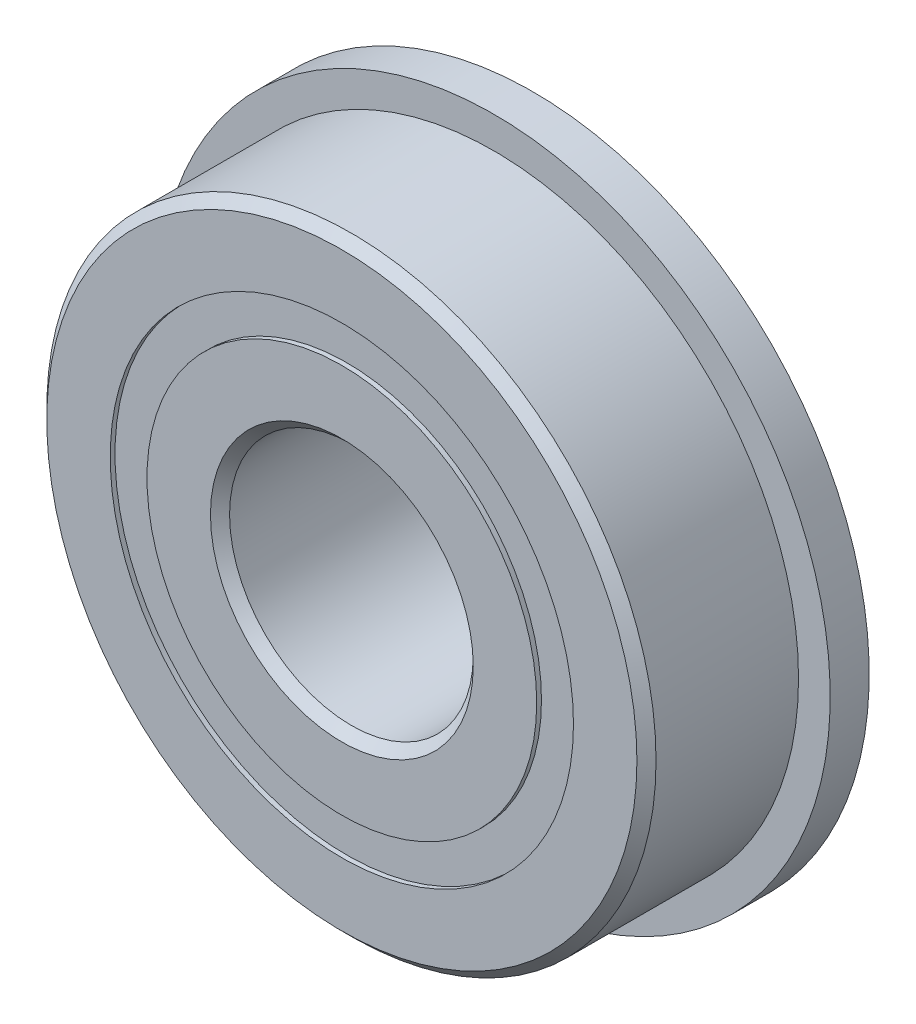
from build123d import *

# Parameters (mm, degrees)
CIRPATTERN1_COUNT = 12
SKETCH5_W         = 1.15919535
SKETCH5_H         = 0.957942858
SKETCH6_W         = 1.016
SKETCH6_H         = 2.727778571


with BuildPart() as part:
    # Sketch1 → Revolve1 (revolve)
    with BuildSketch(Plane(origin=(0, 0, 0), x_dir=(0, 0, -1), z_dir=(1, 0, 0))):
        with BuildLine():
            Line((2.24028, 7.9375), (-2.24028, 7.9375))
            Line((-2.24028, 7.9375), (-2.4892, 7.68858))
            Line((-2.4892, 7.68858), (-2.4892, 6.035221429))
            Line((-2.4892, 6.035221429), (-1.106311111, 6.035221429))
            ThreePointArc((-1.106311111, 6.035221429), (0, 6.76179465), (1.106311111, 6.035221429))
            Line((1.106311111, 6.035221429), (2.4892, 6.035221429))
            Line((2.4892, 6.035221429), (2.4892, 7.68858))
            Line((2.4892, 7.68858), (2.24028, 7.9375))
        make_face()
    revolve(axis=Axis((0, 0, 2.4892), (0, 0, -1)))

    # Sketch6 → Revolve6 (revolve)
    with BuildSketch(Plane(origin=(0, 0, 0), x_dir=(0, 0, -1), z_dir=(1, 0, 0))):
        with Locations((1.9812, 7.399110715)):
            Rectangle(SKETCH6_W, SKETCH6_H)
    revolve(axis=Axis((0, 0, -2.4892), (0, 0, 1)))


with BuildPart() as body_2:
    # Sketch3 → Revolve3 (revolve)
    with BuildSketch(Plane(origin=(0, 0, 0), x_dir=(0, 0, -1), z_dir=(1, 0, 0))):
        with BuildLine():
            Line((-2.4892, 5.077278571), (-1.106311111, 5.077278571))
            ThreePointArc((-1.106311111, 5.077278571), (0, 4.35070535), (1.106311111, 5.077278571))
            Line((1.106311111, 5.077278571), (2.4892, 5.077278571))
            Line((2.4892, 5.077278571), (2.4892, 3.42392))
            Line((2.4892, 3.42392), (2.24028, 3.175))
            Line((2.24028, 3.175), (-2.24028, 3.175))
            Line((-2.24028, 3.175), (-2.4892, 3.42392))
            Line((-2.4892, 3.42392), (-2.4892, 5.077278571))
        make_face()
    revolve(axis=Axis((0, 0, 2.4892), (0, 0, -1)))


with BuildPart() as body_3:
    # Sketch4 → Revolve4 (revolve)
    with BuildSketch(Plane(origin=(0, 0, 0), x_dir=(0, 0, -1), z_dir=(1, 0, 0))):
        with BuildLine():
            Line((-1.20554465, 5.55625), (1.20554465, 5.55625))
            ThreePointArc((1.20554465, 5.55625), (0, 6.76179465), (-1.20554465, 5.55625))
        make_face()
    revolve(axis=Axis((0, 5.55625, 1.20554465), (0, 0, -1)))


with BuildPart() as cirpattern1_1:
    # CirPattern1: pattern copy
    add(body_3.part.rotate(Axis((0, 0, -2.4892), (0, 0, 1)), 1 * 360 / CIRPATTERN1_COUNT))


with BuildPart() as cirpattern1_2:
    # CirPattern1: pattern copy
    add(body_3.part.rotate(Axis((0, 0, -2.4892), (0, 0, 1)), 2 * 360 / CIRPATTERN1_COUNT))


with BuildPart() as cirpattern1_3:
    # CirPattern1: pattern copy
    add(body_3.part.rotate(Axis((0, 0, -2.4892), (0, 0, 1)), 3 * 360 / CIRPATTERN1_COUNT))


with BuildPart() as cirpattern1_4:
    # CirPattern1: pattern copy
    add(body_3.part.rotate(Axis((0, 0, -2.4892), (0, 0, 1)), 4 * 360 / CIRPATTERN1_COUNT))


with BuildPart() as cirpattern1_5:
    # CirPattern1: pattern copy
    add(body_3.part.rotate(Axis((0, 0, -2.4892), (0, 0, 1)), 5 * 360 / CIRPATTERN1_COUNT))


with BuildPart() as cirpattern1_6:
    # CirPattern1: pattern copy
    add(body_3.part.rotate(Axis((0, 0, -2.4892), (0, 0, 1)), 6 * 360 / CIRPATTERN1_COUNT))


with BuildPart() as cirpattern1_7:
    # CirPattern1: pattern copy
    add(body_3.part.rotate(Axis((0, 0, -2.4892), (0, 0, 1)), 7 * 360 / CIRPATTERN1_COUNT))


with BuildPart() as cirpattern1_8:
    # CirPattern1: pattern copy
    add(body_3.part.rotate(Axis((0, 0, -2.4892), (0, 0, 1)), 8 * 360 / CIRPATTERN1_COUNT))


with BuildPart() as cirpattern1_9:
    # CirPattern1: pattern copy
    add(body_3.part.rotate(Axis((0, 0, -2.4892), (0, 0, 1)), 9 * 360 / CIRPATTERN1_COUNT))


with BuildPart() as cirpattern1_10:
    # CirPattern1: pattern copy
    add(body_3.part.rotate(Axis((0, 0, -2.4892), (0, 0, 1)), 10 * 360 / CIRPATTERN1_COUNT))


with BuildPart() as cirpattern1_11:
    # CirPattern1: pattern copy
    add(body_3.part.rotate(Axis((0, 0, -2.4892), (0, 0, 1)), 11 * 360 / CIRPATTERN1_COUNT))


with BuildPart() as body_15:
    # Sketch5 → Revolve5 (revolve)
    with BuildSketch(Plane(origin=(0, 0, 0), x_dir=(0, 0, -1), z_dir=(1, 0, 0))):
        with Locations((-1.785142325, 5.55625)):
            Rectangle(SKETCH5_W, SKETCH5_H)
        with Locations((1.785142325, 5.55625)):
            Rectangle(SKETCH5_W, SKETCH5_H)
    revolve(axis=Axis((0, 0, 2.4892), (0, 0, -1)))


solid = Compound([part.part, body_2.part, body_3.part, cirpattern1_1.part, cirpattern1_2.part, cirpattern1_3.part, cirpattern1_4.part, cirpattern1_5.part, cirpattern1_6.part, cirpattern1_7.part, cirpattern1_8.part, cirpattern1_9.part, cirpattern1_10.part, cirpattern1_11.part, body_15.part])
